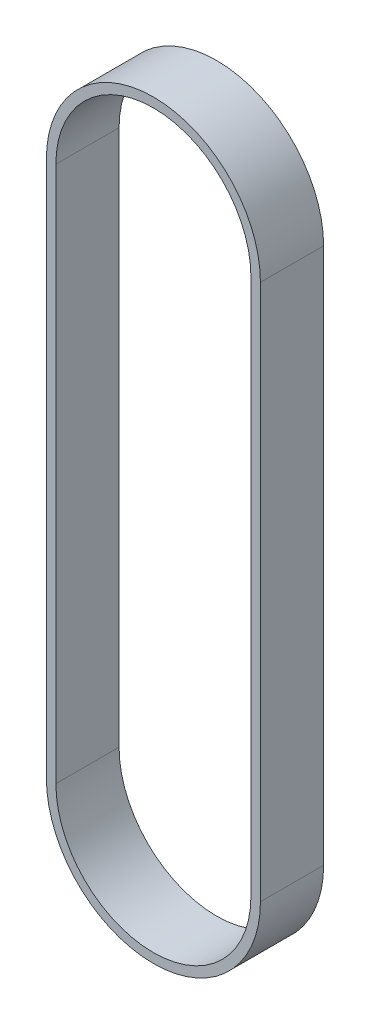
from build123d import *

# Parameters (mm, degrees)
EXTRUDE_1_DEPTH = 5


with BuildPart() as part:
    # 草图2 → 拉伸-薄壁1 (new, symmetric)
    with BuildSketch(Plane.XY):
        with BuildLine():
            Line((-16.935, -84.9), (-16.935, 0))
            ThreePointArc((-16.935, 0), (0, 16.935), (16.935, 0))
            Line((16.935, 0), (16.935, -84.9))
            ThreePointArc((16.935, -84.9), (0, -101.835), (-16.935, -84.9))
        make_face()
        with BuildLine():
            Line((-15.435, -84.9), (-15.435, 0))
            ThreePointArc((-15.435, 0), (0, 15.435), (15.435, 0))
            Line((15.435, 0), (15.435, -84.9))
            ThreePointArc((15.435, -84.9), (0, -100.335), (-15.435, -84.9))
        make_face(mode=Mode.SUBTRACT)
    extrude(amount=EXTRUDE_1_DEPTH, both=True)


solid = part.part
